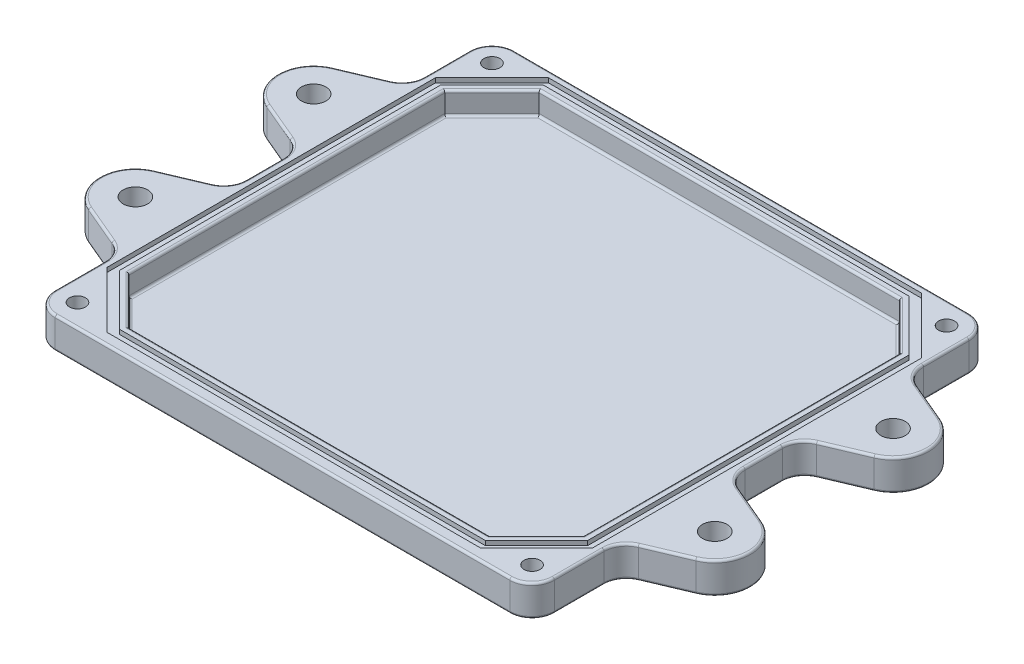
from build123d import *

# Parameters (mm, degrees)
BASE_SKETCH_W                                    = 112
BASE_SKETCH_H                                    = 103
BASE_DEPTH                                       = 7
CORNER_FILLET_R                                  = 5
REAR_LEFT_MOUNTING_FLANGE_SKETCH_R               = 2.75
REAR_LEFT_MOUNTING_FLANGE_DEPTH                  = 7
FRONT_MOUNTING_FLANGES_COPY_1_SKETCH_R           = 2.75
FRONT_MOUNTING_FLANGES_COPY_1_DEPTH              = 7
MOUNTING_FLANGE_FILLET_R                         = 5
TOP_AND_BOTTOM_FILLET_R                          = 0.5
PCB_POCKET_DEPTH                                 = 5
INSIDE_FILLET_R                                  = 0.5
SEALING_CHANNEL_DEPTH                            = 1
CBORE_FOR_M3_HEX_HEAD_MACHINE_SCREW1_D           = 3.6
CBORE_FOR_M3_HEX_HEAD_MACHINE_SCREW1_DEPTH       = 7
CBORE_FOR_M3_HEX_HEAD_MACHINE_SCREW1_CBORE_D     = 6
CBORE_FOR_M3_HEX_HEAD_MACHINE_SCREW1_CBORE_DEPTH = 2
CBORE_FOR_M3_HEX_HEAD_MACHINE_SCREW1_TIP         = 1.081549114


with BuildPart() as part:
    # Base Sketch → Base (new body)
    with BuildSketch(Plane(origin=(0, 0, 0), x_dir=(1, 0, 0), z_dir=(0, 1, 0))):
        with Locations((0, -0.5)):
            Rectangle(BASE_SKETCH_W, BASE_SKETCH_H)
    extrude(amount=BASE_DEPTH)

    # Corner Fillet
    corner_fillet_edges = [part.edges().sort_by_distance(p)[0] for p in [
        (-56, 3.5, -51),
        (56, 3.5, -51),
        (56, 3.5, 52),
        (-56, 3.5, 52),
    ]]
    fillet(corner_fillet_edges, radius=CORNER_FILLET_R)

    # Rear Left Mounting Flange Sketch → Rear Left Mounting Flange (add)
    with BuildSketch(Plane(origin=(0, 0, 0), x_dir=(1, 0, 0), z_dir=(0, 1, 0))):
        with BuildLine():
            Line((-68.120103933, 12.633525168), (-56, 7.5))
            Line((-56, 7.5), (-56, 32.5))
            Line((-56, 32.5), (-68.120103933, 27.366474832))
            ThreePointArc((-68.120103933, 27.366474832), (-73, 20), (-68.120103933, 12.633525168))
        make_face()
        with Locations(Location((-65, 20, 0), (0, 0, 270))):
            Circle(REAR_LEFT_MOUNTING_FLANGE_SKETCH_R, mode=Mode.SUBTRACT)
    rear_left_mounting_flange = extrude(amount=REAR_LEFT_MOUNTING_FLANGE_DEPTH)

    # Rear Right Mounting Flange: Rear Left Mounting Flange across plane
    add(rear_left_mounting_flange.mirror(Plane(origin=(0, 0, 0), x_dir=(0, 0, 1), z_dir=(1, 0, 0))))

    # Front Mounting Flanges: Rear Left Mounting Flange across plane
    add(rear_left_mounting_flange.mirror(Plane.XY))

    # Front Mounting Flanges copy 1 sketch → Front Mounting Flanges copy 1 (add)
    with BuildSketch(Plane(origin=(0, 0, 0), x_dir=(-1, 0, 0), z_dir=(0, 1, 0))):
        with BuildLine():
            Line((-68.120103933, 12.633525168), (-56, 7.5))
            Line((-56, 7.5), (-56, 32.5))
            Line((-56, 32.5), (-68.120103933, 27.366474832))
            ThreePointArc((-68.120103933, 27.366474832), (-73, 20), (-68.120103933, 12.633525168))
        make_face()
        with Locations(Location((-65, 20, 0), (0, 0, 270))):
            Circle(FRONT_MOUNTING_FLANGES_COPY_1_SKETCH_R, mode=Mode.SUBTRACT)
    extrude(amount=FRONT_MOUNTING_FLANGES_COPY_1_DEPTH)

    # Mounting Flange Fillet
    mounting_flange_fillet_edges = [part.edges().sort_by_distance(p)[0] for p in [
        (-56, 3.5, -32.5),
        (-56, 3.5, -7.5),
        (56, 3.5, -32.5),
        (56, 3.5, -7.5),
        (-56, 3.5, 32.5),
        (-56, 3.5, 7.5),
        (56, 3.5, 32.5),
        (56, 3.5, 7.5),
    ]]
    fillet(mounting_flange_fillet_edges, radius=MOUNTING_FLANGE_FILLET_R)

    # Top and Bottom Fillet
    top_and_bottom_fillet_edges = [part.edges().sort_by_distance(p)[0] for p in [
        (-56, 7, 41.406116453),
        (-56, 0, 41.406116453),
        (-63.585019487, 7, 29.287330484),
        (-63.585019487, 0, 29.287330484),
        (56, 7, -40.906116453),
        (56, 0, -40.906116453),
        (63.585019487, 7, -29.287330484),
        (63.585019487, 0, -29.287330484),
        (56, 0, 0),
        (56, 7, 0),
        (63.585019487, 7, 29.287330484),
        (63.585019487, 0, 29.287330484),
        (-56.83164752, 0, -33.050922056),
        (-56.83164752, 7, -33.050922056),
        (-56.83164752, 0, -6.949077944),
        (-56.83164752, 7, -6.949077944),
        (-56.83164752, 0, 6.949077944),
        (-56.83164752, 7, 6.949077944),
        (-56.83164752, 0, 33.050922056),
        (-56.83164752, 7, 33.050922056),
        (56.83164752, 0, -33.050922056),
        (56.83164752, 7, -33.050922056),
        (56.83164752, 0, -6.949077944),
        (56.83164752, 7, -6.949077944),
        (56.83164752, 0, 6.949077944),
        (56.83164752, 7, 6.949077944),
        (56.83164752, 0, 33.050922056),
        (56.83164752, 7, 33.050922056),
        (0, 0, -51),
        (0, 7, -51),
        (-56, 0, -40.906116453),
        (56, 0, 41.406116453),
        (0, 0, 52),
        (-54.535533906, 0, -49.535533906),
        (-54.535533906, 0, 50.535533906),
        (54.535533906, 0, 50.535533906),
        (54.535533906, 0, -49.535533906),
        (56, 7, 41.406116453),
        (-56, 7, -40.906116453),
        (0, 7, 52),
        (-54.535533906, 7, -49.535533906),
        (-54.535533906, 7, 50.535533906),
        (54.535533906, 7, 50.535533906),
        (54.535533906, 7, -49.535533906),
        (-63.585019487, 0, -10.712669516),
        (-73, 0, -20),
        (-73, 7, -20),
        (-63.585019487, 7, -10.712669516),
        (73, 7, -20),
        (63.585019487, 7, -10.712669516),
        (73, 0, -20),
        (63.585019487, 0, -10.712669516),
        (-73, 7, 20),
        (-63.585019487, 7, 10.712669516),
        (-73, 0, 20),
        (-63.585019487, 0, 10.712669516),
        (63.585019487, 0, 10.712669516),
        (73, 0, 20),
        (73, 7, 20),
        (63.585019487, 7, 10.712669516),
        (-63.585019487, 7, -29.287330484),
        (-63.585019487, 0, -29.287330484),
        (-56, 0, 0),
        (-56, 7, 0),
    ]]
    fillet(top_and_bottom_fillet_edges, radius=TOP_AND_BOTTOM_FILLET_R)

    # PCB Pocket Sketch → PCB Pocket (cut)
    with BuildSketch(Plane(origin=(0, 7, 0), x_dir=(1, 0, 0), z_dir=(0, 1, 0))):
        Polygon((-40.414213562, 46), (-51, 35.414213562), (-51, -35.414213562), (-40.414213562, -46), (40.414213562, -46), (51, -35.414213562), (51, 35.414213562), (40.414213562, 46), align=None)
    extrude(amount=-PCB_POCKET_DEPTH, mode=Mode.SUBTRACT)

    # Inside Fillet
    inside_fillet_edges = [part.edges().sort_by_distance(p)[0] for p in [
        (0, 2, -46),
        (45.707106781, 2, -40.707106781),
        (51, 2, 0),
        (45.707106781, 2, 40.707106781),
        (0, 2, 46),
        (-45.707106781, 2, 40.707106781),
        (-51, 2, 0),
        (-45.707106781, 2, -40.707106781),
        (0, 7, -46),
        (-45.707106781, 7, -40.707106781),
        (-51, 7, 0),
        (-45.707106781, 7, 40.707106781),
        (0, 7, 46),
        (45.707106781, 7, 40.707106781),
        (51, 7, 0),
        (45.707106781, 7, -40.707106781),
    ]]
    fillet(inside_fillet_edges, radius=INSIDE_FILLET_R)

    # Sealing Channel Sketch → Sealing Channel (cut)
    with BuildSketch(Plane(origin=(0, 7, 0), x_dir=(1, 0, 0), z_dir=(0, 1, 0))):
        Polygon((-41.863961031, 49.5), (-54.5, 36.863961031), (-54.5, -36.863961031), (-41.863961031, -49.5), (41.863961031, -49.5), (54.5, -36.863961031), (54.5, 36.863961031), (41.863961031, 49.5), align=None)
        Polygon((-41.035533906, 47.5), (-52.5, 36.035533906), (-52.5, -36.035533906), (-41.035533906, -47.5), (41.035533906, -47.5), (52.5, -36.035533906), (52.5, 36.035533906), (41.035533906, 47.5), align=None, mode=Mode.SUBTRACT)
    extrude(amount=-SEALING_CHANNEL_DEPTH, mode=Mode.SUBTRACT)

    # CBORE for M3 Hex Head Machine Screw1
    with Locations(Plane(origin=(0, 0, 0), x_dir=(-1, 0, 0), z_dir=(0, -1, 0))):
        with Locations((51, -47), (51, 46), (-51, 46), (-51, -47)):
            CounterBoreHole(CBORE_FOR_M3_HEX_HEAD_MACHINE_SCREW1_D / 2, CBORE_FOR_M3_HEX_HEAD_MACHINE_SCREW1_CBORE_D / 2, CBORE_FOR_M3_HEX_HEAD_MACHINE_SCREW1_CBORE_DEPTH, depth=CBORE_FOR_M3_HEX_HEAD_MACHINE_SCREW1_DEPTH)
            with Locations((0, 0, -(CBORE_FOR_M3_HEX_HEAD_MACHINE_SCREW1_DEPTH + CBORE_FOR_M3_HEX_HEAD_MACHINE_SCREW1_TIP / 2))):  # 118° drill point
                Cone(0, CBORE_FOR_M3_HEX_HEAD_MACHINE_SCREW1_D / 2, CBORE_FOR_M3_HEX_HEAD_MACHINE_SCREW1_TIP, mode=Mode.SUBTRACT)


solid = part.part
